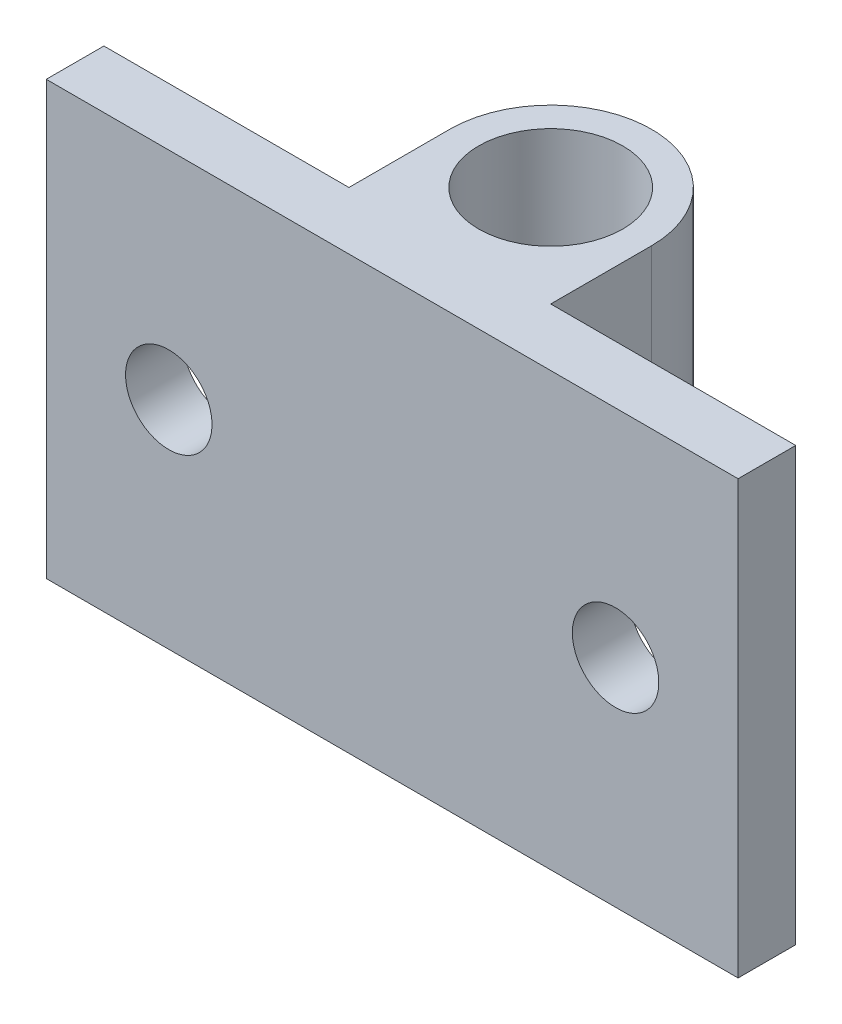
from build123d import *

# Parameters (mm, degrees)
BOSS_EXTRUDE1_DEPTH = 15
CUT_EXTRUDE1_DEPTH  = 21.4450483
SKETCH3_W           = 7
SKETCH3_H           = 7.5
CUT_EXTRUDE2_DEPTH  = 21.4450483


with BuildPart() as part:
    # Sketch1 → Boss-Extrude1 (new body)
    with BuildSketch(Plane(origin=(0, 0, 0), x_dir=(1, 0, 0), z_dir=(0, 1, 0))):
        with BuildLine():
            ThreePointArc((0, 2.5), (1.767766953, 1.767766953), (2.5, 0))
            Line((2.5, 0), (3.5, 0))
            ThreePointArc((3.5, 0), (2.474873734, 2.474873734), (0, 3.5))
            Line((0, 3.5), (0, 2.5))
        make_face()
        with BuildLine():
            Line((-3.5, 0), (-2.5, 0))
            ThreePointArc((-2.5, 0), (-1.767766953, 1.767766953), (0, 2.5))
            Line((0, 2.5), (0, 3.5))
            ThreePointArc((0, 3.5), (-2.474873734, 2.474873734), (-3.5, 0))
        make_face()
        with BuildLine():
            Line((0, -5.5), (0, -2.5))
            ThreePointArc((0, -2.5), (-1.767766953, -1.767766953), (-2.5, 0))
            Line((-2.5, 0), (-3.5, 0))
            Line((-3.5, 0), (-3.5, -3.5))
            Line((-3.5, -3.5), (-12, -3.5))
            Line((-12, -3.5), (-12, -5.5))
            Line((-12, -5.5), (0, -5.5))
        make_face()
        with BuildLine():
            ThreePointArc((2.5, 0), (1.767766953, -1.767766953), (0, -2.5))
            Line((0, -2.5), (0, -5.5))
            Line((0, -5.5), (12, -5.5))
            Line((12, -5.5), (12, -3.5))
            Line((12, -3.5), (3.5, -3.5))
            Line((3.5, -3.5), (3.5, 0))
            Line((3.5, 0), (2.5, 0))
        make_face()
    extrude(amount=BOSS_EXTRUDE1_DEPTH)

    # Sketch2 → Cut-Extrude1 (cut, through all)
    with BuildSketch(Plane(origin=(0, 0, 3.5), x_dir=(-1, 0, 0), z_dir=(0, 0, -1))):
        with BuildLine():
            ThreePointArc((-6.25, 7.5), (-6.689339828, 8.560660172), (-7.75, 9))
            Line((-7.75, 9), (-7.75, 6))
            ThreePointArc((-7.75, 6), (-6.689339828, 6.439339828), (-6.25, 7.5))
        make_face()
        with BuildLine():
            Line((-7.75, 6), (-7.75, 9))
            ThreePointArc((-7.75, 9), (-9.25, 7.5), (-7.75, 6))
        make_face()
        with BuildLine():
            ThreePointArc((9.25, 7.5), (8.810660172, 8.560660172), (7.75, 9))
            Line((7.75, 9), (7.75, 6))
            ThreePointArc((7.75, 6), (8.810660172, 6.439339828), (9.25, 7.5))
        make_face()
        with BuildLine():
            Line((7.75, 6), (7.75, 9))
            ThreePointArc((7.75, 9), (6.25, 7.5), (7.75, 6))
        make_face()
    extrude(amount=-CUT_EXTRUDE1_DEPTH, mode=Mode.SUBTRACT)

    # Sketch3 → Cut-Extrude2 (cut, through all)
    with BuildSketch(Plane(origin=(0, 0, 3.5), x_dir=(-1, 0, 0), z_dir=(0, 0, -1))):
        with Locations((0, 3.75)):
            Rectangle(SKETCH3_W, SKETCH3_H)
    extrude(amount=CUT_EXTRUDE2_DEPTH, mode=Mode.SUBTRACT)


solid = part.part
